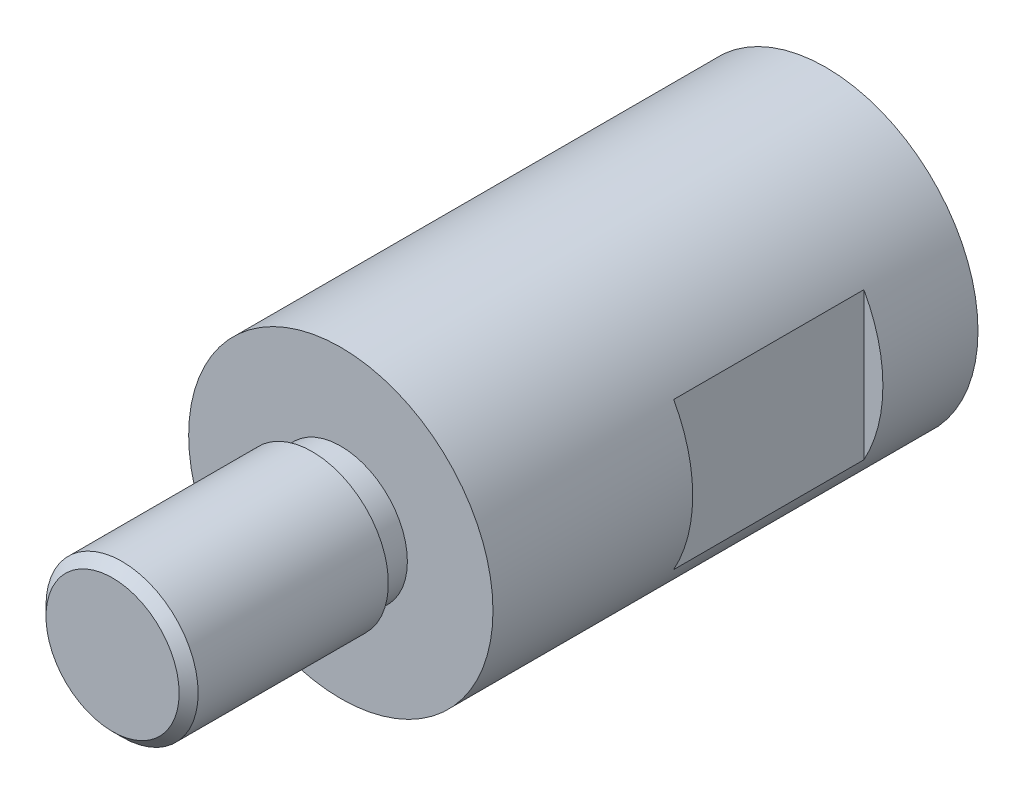
from build123d import *

# Parameters (mm, degrees)
SKETCH_1_R                   = 8
EXTRUDE_1_DEPTH              = 25.5
SKETCH_2_W                   = 1
SKETCH_2_H                   = 10
CUT_EXTRUDE_2_DEPTH          = 9.25
HOLE_WIZARD_M8_1_D           = 6.8
HOLE_WIZARD_M8_1_DEPTH       = 19.75
HOLE_WIZARD_M8_1_CBORE_D     = 8
HOLE_WIZARD_M8_1_CBORE_DEPTH = 16
HOLE_WIZARD_M8_1_TIP         = 2.042926105
SKETCH_4_R                   = 4
EXTRUDE_3_DEPTH              = 12
CHAMFER_1_SIZE               = 0.5
SKETCH_5_W                   = 1.5
SKETCH_5_H                   = 0.930014358


with BuildPart() as part:
    # 草图1 → 拉伸1 (new body)
    with BuildSketch(Plane.XY):
        Circle(SKETCH_1_R)
    extrude(amount=EXTRUDE_1_DEPTH)

    # 草图2 → 拉伸2 (cut, symmetric)
    with BuildSketch(Plane(origin=(0, 0, 0), x_dir=(1, 0, 0), z_dir=(0, 1, 0))):
        with Locations((-7.5, -10)):
            Rectangle(SKETCH_2_W, SKETCH_2_H)
        with Locations((7.5, -10)):
            Rectangle(SKETCH_2_W, SKETCH_2_H)
    extrude(amount=CUT_EXTRUDE_2_DEPTH, both=True, mode=Mode.SUBTRACT)

    # M8 螺纹孔1
    with Locations(Plane(origin=(0, 0, 0), x_dir=(-1, 0, 0), z_dir=(0, 0, -1))):
        with Locations((0, 0)):
            CounterBoreHole(HOLE_WIZARD_M8_1_D / 2, HOLE_WIZARD_M8_1_CBORE_D / 2, HOLE_WIZARD_M8_1_CBORE_DEPTH, depth=HOLE_WIZARD_M8_1_DEPTH)
            with Locations((0, 0, -(HOLE_WIZARD_M8_1_DEPTH + HOLE_WIZARD_M8_1_TIP / 2))):  # 118° drill point
                Cone(0, HOLE_WIZARD_M8_1_D / 2, HOLE_WIZARD_M8_1_TIP, mode=Mode.SUBTRACT)

    # 草图4 → 拉伸3 (add)
    with BuildSketch(Plane.XY.offset(25.5)):
        with Locations(Location((0, 0, 0), (0, 0, 180))):
            Circle(SKETCH_4_R)
    extrude(amount=EXTRUDE_3_DEPTH)

    # 倒角1
    chamfer_1_edges = [part.edges().sort_by_distance(p)[0] for p in [
        (4, 0, 37.5),
    ]]
    chamfer(chamfer_1_edges, length=CHAMFER_1_SIZE)

    # 草图5 → 切除-旋转1 (revolve, cut)
    with BuildSketch(Plane(origin=(0, 0, 0), x_dir=(0, 0, -1), z_dir=(1, 0, 0)), mode=Mode.PRIVATE) as cut_revolve_1_sk:
        with Locations((-26.25, 3.965007179)):
            Rectangle(SKETCH_5_W, SKETCH_5_H)
    revolve(cut_revolve_1_sk.sketch.rotate(Axis((0, 0, 25.5), (0, 0, -1)), 270), axis=Axis((0, 0, 25.5), (0, 0, -1)), mode=Mode.SUBTRACT)


solid = part.part
